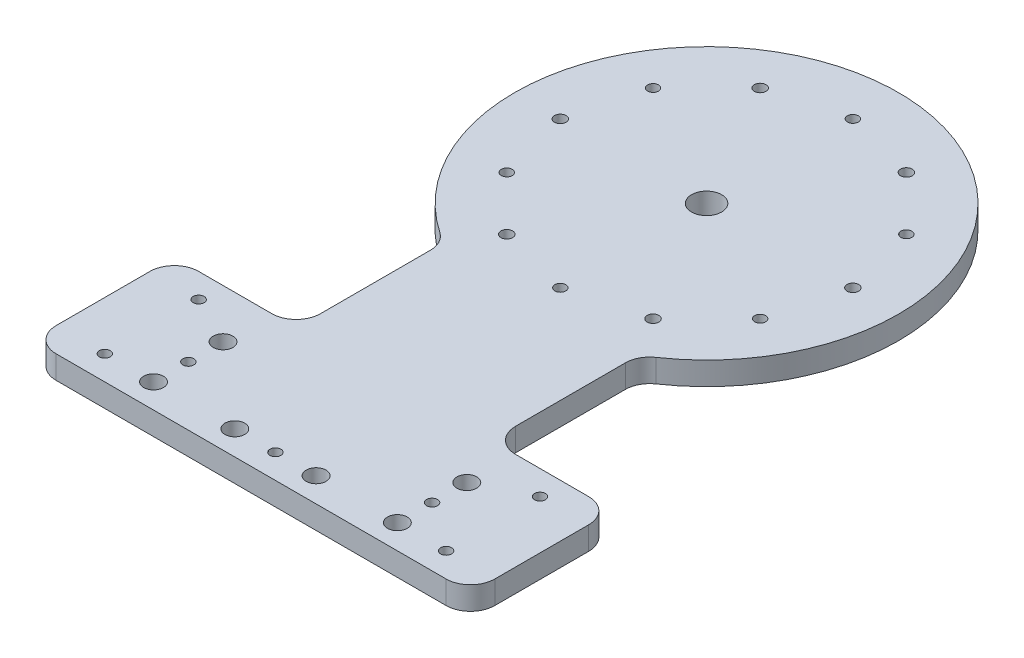
from build123d import *

# Parameters (mm, degrees)
SKETCH1_W           = 300
SKETCH1_H           = 200
BOSS_EXTRUDE1_DEPTH = 6
SKETCH6_R           = 4
CUT_EXTRUDE2_DEPTH  = 361.605047108
FILLET1_R           = 6.35
SKETCH2_R           = 1.5
CUT_EXTRUDE1_DEPTH  = 361.605047108
SKETCH16_R          = 2.65
M5_THROUGH_DEPTH    = 358.420816406
SKETCH9_R           = 1.5
CUT_EXTRUDE3_DEPTH  = 361.605047108
SKETCH10_R          = 1.5
CUT_EXTRUDE5_DEPTH  = 361.605047108
SKETCH17_R          = 1.6
M3_THROUGH_DEPTH    = 268.189599912
FILLET2_R           = 6.35
MOVE_FACE1_BY       = 0.08
MOVE_FACE1_2_BY     = 0.08
MOVE_FACE1_3_BY     = 0.08
MOVE_FACE1_4_BY     = 0.08
MOVE_FACE1_5_BY     = 0.08
MOVE_FACE1_6_BY     = 0.08
MOVE_FACE1_7_BY     = 0.08
MOVE_FACE1_8_BY     = 0.08
MOVE_FACE1_9_BY     = 0.08
MOVE_FACE1_10_BY    = 0.08
MOVE_FACE1_11_BY    = 0.08
MOVE_FACE1_12_BY    = 0.08
MOVE_FACE1_13_BY    = 0.08
MOVE_FACE1_14_BY    = 0.08
MOVE_FACE1_15_BY    = 0.08
MOVE_FACE1_16_BY    = 0.08
MOVE_FACE1_17_BY    = 0.08
MOVE_FACE1_18_BY    = 0.08
MOVE_FACE1_19_BY    = 0.08
MOVE_FACE1_20_BY    = 0.08
MOVE_FACE1_21_BY    = 0.08
MOVE_FACE1_22_BY    = 0.08
MOVE_FACE1_23_BY    = 0.08
MOVE_FACE1_24_BY    = 0.08
MOVE_FACE1_25_BY    = 0.08
MOVE_FACE1_26_BY    = 0.08


with BuildPart() as part:
    # Sketch1 → Boss-Extrude1 (new body)
    with BuildSketch(Plane(origin=(0, 0, 0), x_dir=(1, 0, 0), z_dir=(0, 1, 0))):
        with Locations((150, 100)):
            Rectangle(SKETCH1_W, SKETCH1_H)
    extrude(amount=BOSS_EXTRUDE1_DEPTH)

    # Sketch6 → Cut-Extrude2 (cut, through all)
    with BuildSketch(Plane(origin=(0, 6, 0), x_dir=(1, 0, 0), z_dir=(0, 1, 0))):
        with Locations(Location((150, 118.651, 0), (0, 0, 270))):
            Circle(SKETCH6_R)
    extrude(amount=-CUT_EXTRUDE2_DEPTH, mode=Mode.SUBTRACT)

    # Fillet1
    fillet1_edges = [part.edges().sort_by_distance(p)[0] for p in [
        (0, 3, -200),
        (300, 3, -200),
        (300, 3, 0),
        (0, 3, 0),
    ]]
    fillet(fillet1_edges, radius=FILLET1_R)

    # Sketch2 → Cut-Extrude1 (cut, through all)
    with BuildSketch(Plane(origin=(0, 6, 0), x_dir=(1, 0, 0), z_dir=(0, 1, 0))):
        with Locations(Location((6.35, 174.6, 0), (0, 0, 270))):
            Circle(SKETCH2_R)
        with Locations(Location((6.35, 49.9999, 0), (0, 0, 270))):
            Circle(SKETCH2_R)
        with Locations(Location((249.2, 75.3999, 0), (0, 0, 270))):
            Circle(SKETCH2_R)
        with Locations(Location((50.8, 75.3999, 0), (0, 0, 270))):
            Circle(SKETCH2_R)
        with Locations(Location((293.65, 49.9999, 0), (0, 0, 270))):
            Circle(SKETCH2_R)
        with Locations(Location((50.8, 24.5999, 0), (0, 0, 270))):
            Circle(SKETCH2_R)
        with Locations(Location((249.2, 24.5999, 0), (0, 0, 270))):
            Circle(SKETCH2_R)
        with Locations(Location((25.4, 193.65, 0), (0, 0, 270))):
            Circle(SKETCH2_R)
        with Locations(Location((274.6, 193.65, 0), (0, 0, 270))):
            Circle(SKETCH2_R)
        with Locations(Location((293.65, 174.6, 0), (0, 0, 270))):
            Circle(SKETCH2_R)
    extrude(amount=-CUT_EXTRUDE1_DEPTH, mode=Mode.SUBTRACT)

    # Sketch16 → M5_through (cut, through all)
    with BuildSketch(Plane(origin=(0, 6, -5.8), x_dir=(1, 0, 0), z_dir=(0, -1, 0))):
        with Locations(Location((118.25, -18.651, 0), (0, 0, 270))):
            Circle(SKETCH16_R)
        with Locations(Location((118.25, -0.55096, 0), (0, 0, 270))):
            Circle(SKETCH16_R)
        with Locations(Location((139.416666667, -0.55096, 0), (0, 0, 270))):
            Circle(SKETCH16_R)
        with Locations(Location((160.583333333, -0.55096, 0), (0, 0, 270))):
            Circle(SKETCH16_R)
        with Locations(Location((181.75, -0.55096, 0), (0, 0, 270))):
            Circle(SKETCH16_R)
        with Locations(Location((181.75, -18.651, 0), (0, 0, 270))):
            Circle(SKETCH16_R)
    extrude(amount=M5_THROUGH_DEPTH, mode=Mode.SUBTRACT)

    # Sketch9 → Cut-Extrude3 (cut, through all)
    with BuildSketch(Plane(origin=(0, 6, 0), x_dir=(-1, 0, 0), z_dir=(0, 1, 0))):
        with Locations(Location((-118.25, -15.40098, 0), (0, 0, 90))):
            Circle(SKETCH9_R)
        with Locations(Location((-150, -6.35096, 0), (0, 0, 90))):
            Circle(SKETCH9_R)
        with Locations(Location((-181.75, -15.40098, 0), (0, 0, 90))):
            Circle(SKETCH9_R)
    extrude(amount=-CUT_EXTRUDE3_DEPTH, mode=Mode.SUBTRACT)

    # Sketch10 → Cut-Extrude5 (cut, through all)
    with BuildSketch(Plane(origin=(0, 6, 0), x_dir=(1, 0, 0), z_dir=(0, 1, 0))):
        with Locations(Location((150, 156.751, 0), (0, 0, 270))):
            Circle(SKETCH10_R)
        with Locations(Location((182.995567884, 137.701, 0), (0, 0, 270))):
            Circle(SKETCH10_R)
        with Locations(Location((182.995567884, 99.601, 0), (0, 0, 270))):
            Circle(SKETCH10_R)
        with Locations(Location((150, 80.551, 0), (0, 0, 270))):
            Circle(SKETCH10_R)
        with Locations(Location((117.004432116, 99.601, 0), (0, 0, 270))):
            Circle(SKETCH10_R)
        with Locations(Location((117.004432116, 137.701, 0), (0, 0, 270))):
            Circle(SKETCH10_R)
        with Locations(Location((105.55, 30.801, 0), (0, 0, 270))):
            Circle(SKETCH10_R)
        with Locations(Location((105.55, 6.35, 0), (0, 0, 270))):
            Circle(SKETCH10_R)
        with Locations(Location((194.45, 6.35, 0), (0, 0, 90))):
            Circle(SKETCH10_R)
        with Locations(Location((194.45, 30.801, 0), (0, 0, 90))):
            Circle(SKETCH10_R)
        with BuildLine():
            Line((124.6, 75.583146559), (124.6, 37.151))
            Line((124.6, 37.151), (92.85, 37.151))
            Line((92.85, 37.151), (92.85, 0))
            Line((92.85, 0), (0, 0))
            Line((0, 0), (0, 200))
            Line((0, 200), (300, 200))
            Line((300, 200), (300, 0))
            Line((300, 0), (207.15, 0))
            Line((207.15, 0), (207.15, 37.151))
            Line((207.15, 37.151), (175.4, 37.151))
            Line((175.4, 37.151), (175.4, 75.583146559))
            ThreePointArc((175.4, 75.583146559), (150, 168.651), (124.6, 75.583146559))
        make_face()
    extrude(amount=-CUT_EXTRUDE5_DEPTH, mode=Mode.SUBTRACT)

    # Sketch17 → M3-through (cut, through all)
    with BuildSketch(Plane(origin=(0, 6, 0), x_dir=(1, 0, 0), z_dir=(0, 1, 0))):
        with Locations(Location((188.1, 118.651, 0), (0, 0, 270))):
            Circle(SKETCH17_R)
        with Locations(Location((169.05, 85.655432116, 0), (0, 0, 270))):
            Circle(SKETCH17_R)
        with Locations(Location((130.95, 85.655432116, 0), (0, 0, 270))):
            Circle(SKETCH17_R)
        with Locations(Location((111.9, 118.651, 0), (0, 0, 270))):
            Circle(SKETCH17_R)
        with Locations(Location((130.95, 151.646567884, 0), (0, 0, 270))):
            Circle(SKETCH17_R)
        with Locations(Location((169.05, 151.646567884, 0), (0, 0, 270))):
            Circle(SKETCH17_R)
    extrude(amount=-M3_THROUGH_DEPTH, mode=Mode.SUBTRACT)

    # Fillet2
    fillet2_edges = [part.edges().sort_by_distance(p)[0] for p in [
        (175.4, 3, -75.583146559),
        (124.6, 3, -75.583146559),
        (124.6, 3, -37.151),
        (92.85, 3, -37.151),
        (92.85, 3, 0),
        (207.15, 3, 0),
        (207.15, 3, -37.151),
        (175.4, 3, -37.151),
    ]]
    fillet(fillet2_edges, radius=FILLET2_R)

    # Move Face1: a curved face moved outward by 0.08
    add(Solid.thicken(part.faces().sort_by_distance((150, 3, -122.651))[0], MOVE_FACE1_BY))

    # Move Face1 2: a curved face moved outward by 0.08
    add(Solid.thicken(part.faces().sort_by_distance((118.25, 3, -21.801))[0], MOVE_FACE1_2_BY))

    # Move Face1 3: a curved face moved outward by 0.08
    add(Solid.thicken(part.faces().sort_by_distance((118.25, 3, -3.70096))[0], MOVE_FACE1_3_BY))

    # Move Face1 4: a curved face moved outward by 0.08
    add(Solid.thicken(part.faces().sort_by_distance((139.416666667, 3, -3.70096))[0], MOVE_FACE1_4_BY))

    # Move Face1 5: a curved face moved outward by 0.08
    add(Solid.thicken(part.faces().sort_by_distance((160.583333333, 3, -3.70096))[0], MOVE_FACE1_5_BY))

    # Move Face1 6: a curved face moved outward by 0.08
    add(Solid.thicken(part.faces().sort_by_distance((181.75, 3, -3.70096))[0], MOVE_FACE1_6_BY))

    # Move Face1 7: a curved face moved outward by 0.08
    add(Solid.thicken(part.faces().sort_by_distance((181.75, 3, -21.801))[0], MOVE_FACE1_7_BY))

    # Move Face1 8: a curved face moved outward by 0.08
    add(Solid.thicken(part.faces().sort_by_distance((118.25, 3, -16.90098))[0], MOVE_FACE1_8_BY))

    # Move Face1 9: a curved face moved outward by 0.08
    add(Solid.thicken(part.faces().sort_by_distance((150, 3, -7.85096))[0], MOVE_FACE1_9_BY))

    # Move Face1 10: a curved face moved outward by 0.08
    add(Solid.thicken(part.faces().sort_by_distance((181.75, 3, -16.90098))[0], MOVE_FACE1_10_BY))

    # Move Face1 11: a curved face moved outward by 0.08
    add(Solid.thicken(part.faces().sort_by_distance((150, 3, -158.251))[0], MOVE_FACE1_11_BY))

    # Move Face1 12: a curved face moved outward by 0.08
    add(Solid.thicken(part.faces().sort_by_distance((182.995567884, 3, -139.201))[0], MOVE_FACE1_12_BY))

    # Move Face1 13: a curved face moved outward by 0.08
    add(Solid.thicken(part.faces().sort_by_distance((182.995567884, 3, -101.101))[0], MOVE_FACE1_13_BY))

    # Move Face1 14: a curved face moved outward by 0.08
    add(Solid.thicken(part.faces().sort_by_distance((150, 3, -82.051))[0], MOVE_FACE1_14_BY))

    # Move Face1 15: a curved face moved outward by 0.08
    add(Solid.thicken(part.faces().sort_by_distance((117.004432116, 3, -101.101))[0], MOVE_FACE1_15_BY))

    # Move Face1 16: a curved face moved outward by 0.08
    add(Solid.thicken(part.faces().sort_by_distance((117.004432116, 3, -139.201))[0], MOVE_FACE1_16_BY))

    # Move Face1 17: a curved face moved outward by 0.08
    add(Solid.thicken(part.faces().sort_by_distance((105.55, 3, -32.301))[0], MOVE_FACE1_17_BY))

    # Move Face1 18: a curved face moved outward by 0.08
    add(Solid.thicken(part.faces().sort_by_distance((105.55, 3, -7.85))[0], MOVE_FACE1_18_BY))

    # Move Face1 19: a curved face moved outward by 0.08
    add(Solid.thicken(part.faces().sort_by_distance((194.45, 3, -4.85))[0], MOVE_FACE1_19_BY))

    # Move Face1 20: a curved face moved outward by 0.08
    add(Solid.thicken(part.faces().sort_by_distance((194.45, 3, -29.301))[0], MOVE_FACE1_20_BY))

    # Move Face1 21: a curved face moved outward by 0.08
    add(Solid.thicken(part.faces().sort_by_distance((188.1, 3, -120.251))[0], MOVE_FACE1_21_BY))

    # Move Face1 22: a curved face moved outward by 0.08
    add(Solid.thicken(part.faces().sort_by_distance((169.05, 3, -87.255432116))[0], MOVE_FACE1_22_BY))

    # Move Face1 23: a curved face moved outward by 0.08
    add(Solid.thicken(part.faces().sort_by_distance((130.95, 3, -87.255432116))[0], MOVE_FACE1_23_BY))

    # Move Face1 24: a curved face moved outward by 0.08
    add(Solid.thicken(part.faces().sort_by_distance((111.9, 3, -120.251))[0], MOVE_FACE1_24_BY))

    # Move Face1 25: a curved face moved outward by 0.08
    add(Solid.thicken(part.faces().sort_by_distance((130.95, 3, -153.246567884))[0], MOVE_FACE1_25_BY))

    # Move Face1 26: a curved face moved outward by 0.08
    add(Solid.thicken(part.faces().sort_by_distance((169.05, 3, -153.246567884))[0], MOVE_FACE1_26_BY))


solid = part.part
